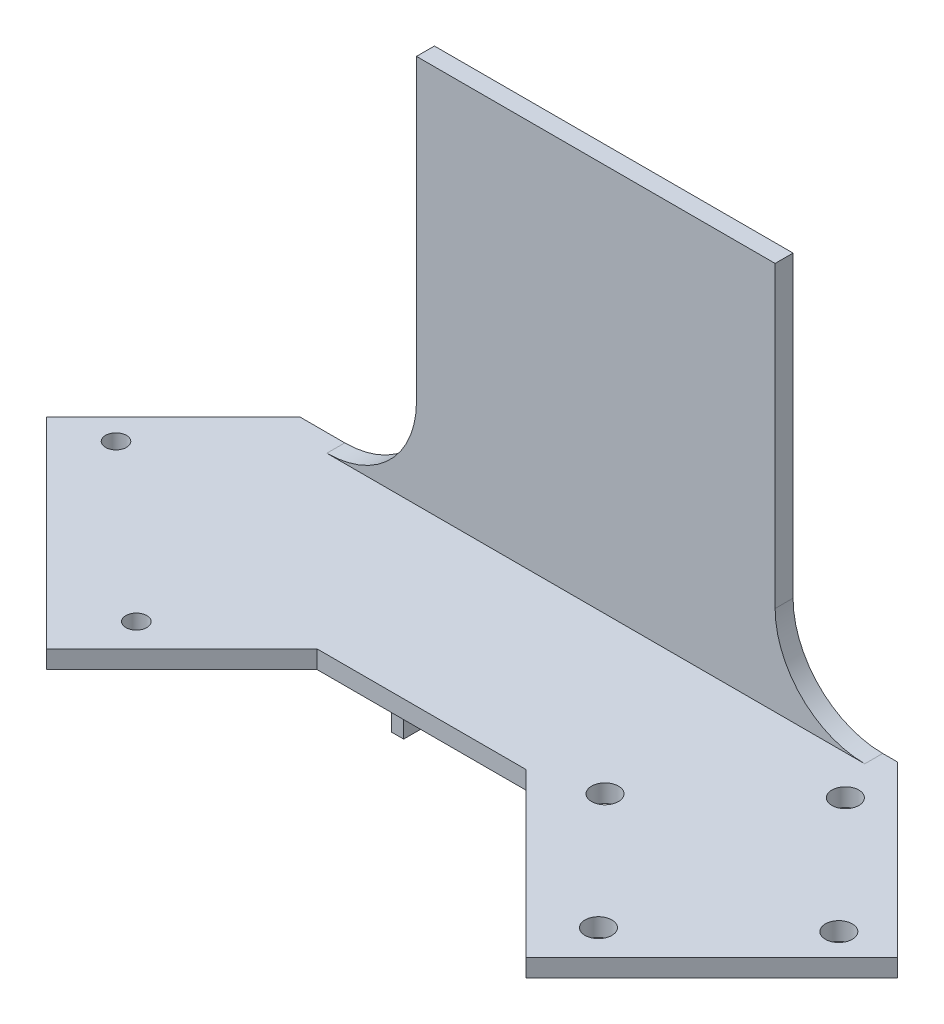
from build123d import *

# Parameters (mm, degrees)
BOSS_EXTRUDE1_DEPTH = 20
SKETCH2_R           = 1.75
SKETCH2_R_2         = 2.25
BOSS_EXTRUDE2_DEPTH = 3
FILLET1_R           = 8
SKETCH3_W           = 60
SKETCH3_H           = 3
BOSS_EXTRUDE3_DEPTH = 65
FILLET2_R           = 15


with BuildPart() as part:
    # Sketch1 → Boss-Extrude1 (new body)
    with BuildSketch(Plane(origin=(0, 0, 0), x_dir=(1, 0, 0), z_dir=(0, 1, 0))):
        Polygon((-17.65, -1), (17.65, -1), (17.65, -14), (19.65, -14), (19.65, -1), (19.65, 1), (-19.65, 1), (-19.65, -1), (-19.65, -14), (-17.65, -14), align=None)
    extrude(amount=BOSS_EXTRUDE1_DEPTH)

    # Sketch2 → Boss-Extrude2 (add)
    with BuildSketch(Plane(origin=(0, 20, 0), x_dir=(1, 0, 0), z_dir=(0, 1, 0))):
        Polygon((-50, 1), (50, 1), (78.284271247, -27.284271247), (47.202085299, -58.366457196), (20, -31.164371897), (-15, -31.164371897), (-37.631017487, -53.795389384), (-71.213203436, -20.213203436), align=None)
        with Locations(Location((-61.850146281, -17.921214092, 0), (0, 0, 270))):
            Circle(SKETCH2_R, mode=Mode.SUBTRACT)
        with Locations(Location((-34.042532687, -42.328930623, 0), (0, 0, 270))):
            Circle(SKETCH2_R, mode=Mode.SUBTRACT)
        with Locations(Location((48.962338505, -48.018545271, 0), (0, 0, 270))):
            Circle(SKETCH2_R_2, mode=Mode.SUBTRACT)
        with Locations(Location((69.638225821, -28.478934535, 0), (0, 0, 90))):
            Circle(SKETCH2_R_2, mode=Mode.SUBTRACT)
        with Locations(Location((50.796458326, -8.541471766, 0), (0, 0, 270))):
            Circle(SKETCH2_R_2, mode=Mode.SUBTRACT)
        with Locations(Location((30.12057101, -28.081082501, 0), (0, 0, 90))):
            Circle(SKETCH2_R_2, mode=Mode.SUBTRACT)
    extrude(amount=BOSS_EXTRUDE2_DEPTH)

    # Fillet1
    fillet1_edges = [part.edges().sort_by_distance(p)[0] for p in [
        (-17.65, 20, 7.5),
        (0, 20, 1),
        (17.65, 20, 7.5),
    ]]
    fillet(fillet1_edges, radius=FILLET1_R)

    # Sketch3 → Boss-Extrude3 (add)
    with BuildSketch(Plane(origin=(0, 23, 0), x_dir=(1, 0, 0), z_dir=(0, 1, 0))):
        with Locations((2.5, -0.5)):
            Rectangle(SKETCH3_W, SKETCH3_H)
    extrude(amount=BOSS_EXTRUDE3_DEPTH)

    # Fillet2
    fillet2_edges = [part.edges().sort_by_distance(p)[0] for p in [
        (32.5, 23, 0.5),
        (-27.5, 23, 0.5),
    ]]
    fillet(fillet2_edges, radius=FILLET2_R)


solid = part.part
